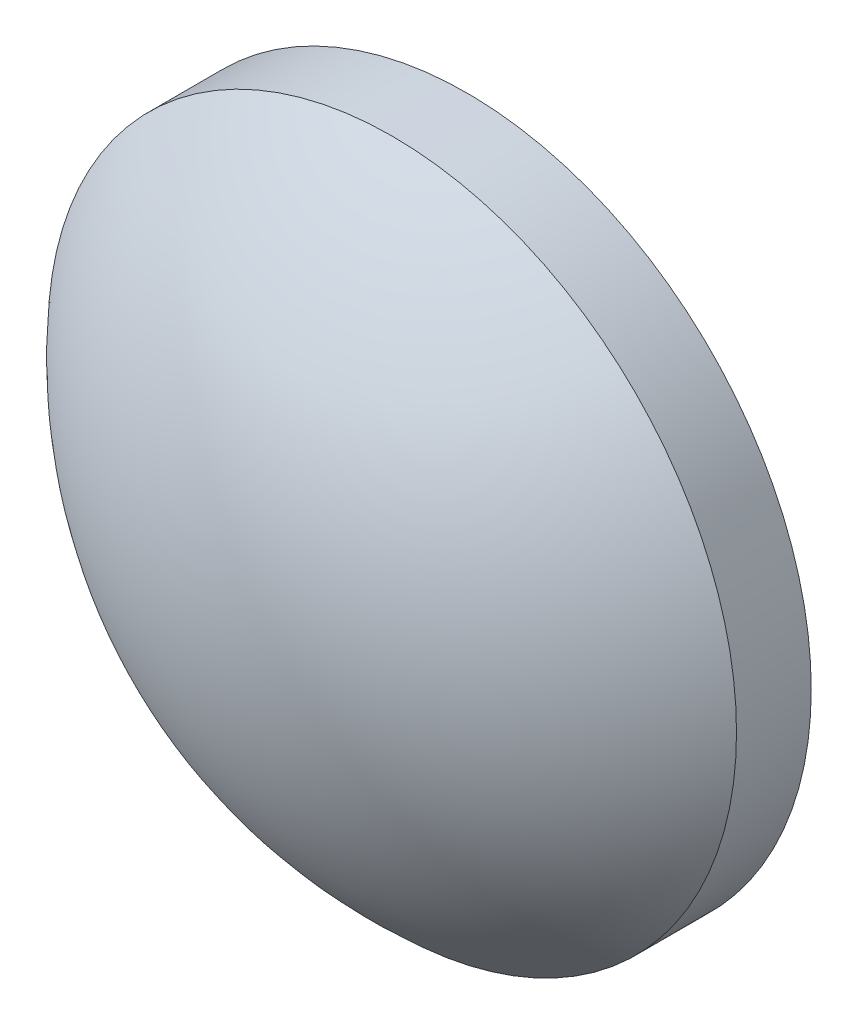
from build123d import *


with BuildPart() as part:
    # Эскиз1 → Повернуть6 (revolve)
    with BuildSketch(Plane(origin=(0, 0, 0), x_dir=(0, 0, -1), z_dir=(1, 0, 0)), mode=Mode.PRIVATE) as revolve_6_sk:
        with BuildLine():
            Line((0.972510965, 2.998480652), (0.32170289, 2.998480652))
            ThreePointArc((0.32170289, 2.998480652), (-0.677047568, 1.64470478), (-1.030824016, 0))
            Line((-1.030824016, 0), (0.972510965, 0))
            Line((0.972510965, 0), (0.972510965, 2.998480652))
        make_face()
    revolve(revolve_6_sk.sketch.rotate(Axis((0, 0, 1.922063247), (0, 0, -1)), 90), axis=Axis((0, 0, 1.922063247), (0, 0, -1)))


solid = part.part
